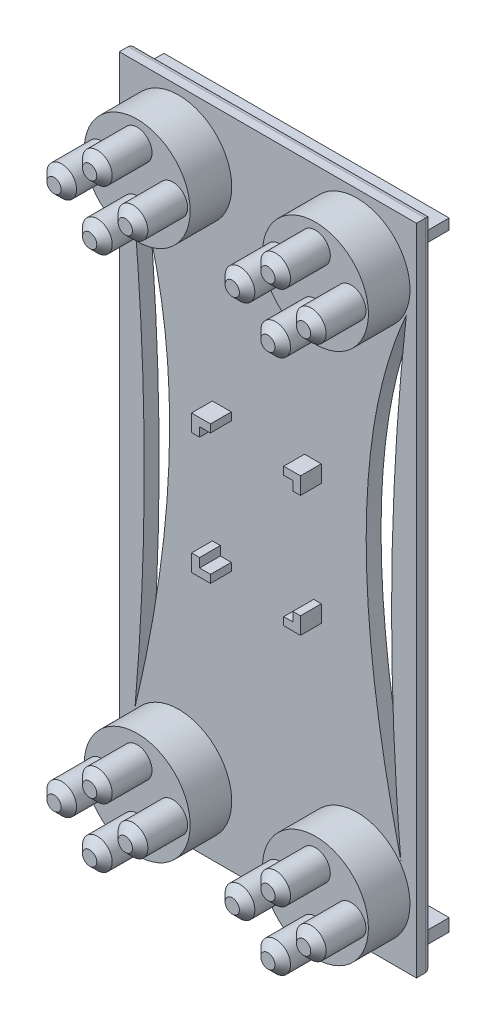
from build123d import *

# Parameters (mm, degrees)
CROQUIS1_W              = 50
CROQUIS1_H              = 110
SALIENTE_EXTRUIR1_DEPTH = 2.5
CROQUIS2_R              = 2.5
SALIENTE_EXTRUIR2_DEPTH = 15
CHAFL_N1_SIZE           = 1.3
REDONDEO1_R             = 1
CORTAR_EXTRUIR1_DEPTH   = 10
CROQUIS5_R              = 8.912982345
SALIENTE_EXTRUIR5_DEPTH = 7
SALIENTE_EXTRUIR6_DEPTH = 6
CROQUIS6_W              = 48
CROQUIS6_H              = 1.766405202
CROQUIS6_H_2            = 2.105673341
SALIENTE_EXTRUIR7_DEPTH = 4


with BuildPart() as part:
    # Croquis1 → Saliente-Extruir1 (new body)
    with BuildSketch(Plane.XY):
        Rectangle(CROQUIS1_W, CROQUIS1_H)
    extrude(amount=SALIENTE_EXTRUIR1_DEPTH)

    # Croquis2 → Saliente-Extruir2 (add)
    with BuildSketch(Plane.XY.offset(2.5)):
        with Locations((-15, 50)):
            Circle(CROQUIS2_R)
        with Locations((-21, 45)):
            Circle(CROQUIS2_R)
        with Locations((-15, 40)):
            Circle(CROQUIS2_R)
        with Locations((-9, 45)):
            Circle(CROQUIS2_R)
        with Locations((-15, -40)):
            Circle(CROQUIS2_R)
        with Locations((-9, -45)):
            Circle(CROQUIS2_R)
        with Locations((-15, -50)):
            Circle(CROQUIS2_R)
        with Locations((-21, -45)):
            Circle(CROQUIS2_R)
        with Locations((21, -45)):
            Circle(CROQUIS2_R)
        with Locations((15, -50)):
            Circle(CROQUIS2_R)
        with Locations((9, -45)):
            Circle(CROQUIS2_R)
        with Locations((15, -40)):
            Circle(CROQUIS2_R)
        with Locations((21, 45)):
            Circle(CROQUIS2_R)
        with Locations((15, 50)):
            Circle(CROQUIS2_R)
        with Locations((9, 45)):
            Circle(CROQUIS2_R)
        with Locations((15, 40)):
            Circle(CROQUIS2_R)
    extrude(amount=SALIENTE_EXTRUIR2_DEPTH)

    # Chaflán1
    chafl_n1_edges = [part.edges().sort_by_distance(p)[0] for p in [
        (-23.5, 45, 17.5),
        (-17.5, 40, 17.5),
        (-17.5, 50, 17.5),
        (-11.5, 45, 17.5),
        (6.5, 45, 17.5),
        (12.5, 40, 17.5),
        (12.5, 50, 17.5),
        (18.5, 45, 17.5),
        (18.5, -45, 17.5),
        (12.5, -50, 17.5),
        (12.5, -40, 17.5),
        (6.5, -45, 17.5),
        (-11.5, -45, 17.5),
        (-17.5, -50, 17.5),
        (-17.5, -40, 17.5),
        (-23.5, -45, 17.5),
    ]]
    chamfer(chafl_n1_edges, length=CHAFL_N1_SIZE)

    # Redondeo1
    redondeo1_edges = [part.edges().sort_by_distance(p)[0] for p in [
        (0, 55, 0),
        (-25, 0, 0),
        (0, -55, 0),
        (25, 0, 0),
    ]]
    fillet(redondeo1_edges, radius=REDONDEO1_R)

    # Croquis3 → Cortar-Extruir1 (cut)
    with BuildSketch(Plane(origin=(0, 0, 0), x_dir=(-1, 0, 0), z_dir=(0, 0, -1))):
        with BuildLine():
            add(Edge.make_bspline(
                [(22.361475253, -39.186991388), (10.271319675, 11.528482347), (23.288602916, 40.714890738)],
                knots=[0, 0, 0, 1, 1, 1], degree=2))
            add(Edge.make_bspline(
                [(22.361475253, -39.186991388), (20.200722134, -14.449114626), (20.113642926, 12.226208442), (23.288602916, 40.714890738)],
                knots=[0, 0, 0, 0, 1, 1, 1, 1], degree=3))
        make_face()
        with BuildLine():
            add(Edge.make_bspline(
                [(-22.361475253, -39.186991388), (-20.200722134, -14.449114626), (-20.113642926, 12.226208442), (-23.288602916, 40.714890738)],
                knots=[0, 0, 0, 0, 1, 1, 1, 1], degree=3))
            add(Edge.make_bspline(
                [(-22.361475253, -39.186991388), (-10.271319675, 11.528482347), (-23.288602916, 40.714890738)],
                knots=[0, 0, 0, 1, 1, 1], degree=2))
        make_face()
    extrude(amount=-CORTAR_EXTRUIR1_DEPTH, mode=Mode.SUBTRACT)

    # Croquis5 → Saliente-Extruir5 (add)
    with BuildSketch(Plane.XY.offset(2.5)):
        with Locations((-15, 44.758672209)):
            Circle(CROQUIS5_R)
        with Locations((-15, -44.758672209)):
            Circle(CROQUIS5_R)
        with Locations((15, 44.758672209)):
            Circle(CROQUIS5_R)
        with Locations((15, -44.758672209)):
            Circle(CROQUIS5_R)
    extrude(amount=SALIENTE_EXTRUIR5_DEPTH)

    # Croquis4 → Saliente-Extruir6 (add)
    with BuildSketch(Plane(origin=(0, 0, 0), x_dir=(-1, 0, 0), z_dir=(0, 0, -1))):
        Polygon((-7.7, 9.070517568), (-7.7, 10.6), (-6.163131116, 10.6), (-6.163131116, 11.924666471), (-8.979725427, 11.924666471), (-8.979725427, 9.070517568), align=None)
        Polygon((-6.163131116, -10), (-7.7, -10), (-7.7, -8.470517568), (-8.979725427, -8.470517568), (-8.979725427, -11.324666471), (-6.163131116, -11.324666471), align=None)
        Polygon((6.163131116, 10.6), (8, 10.6), (8, 9.070517568), (9.349963895, 9.070517568), (9.349963895, 11.924666471), (6.163131116, 11.924666471), align=None)
        Polygon((9.349963895, -8.470517568), (8, -8.470517568), (8, -10), (6.163131116, -10), (6.163131116, -11.324666471), (9.349963895, -11.324666471), align=None)
    extrude(amount=-SALIENTE_EXTRUIR6_DEPTH)

    # Croquis6 → Saliente-Extruir7 (add)
    with BuildSketch(Plane(origin=(0, 0, 0), x_dir=(-1, 0, 0), z_dir=(0, 0, -1))):
        with Locations((0, 51.133202601)):
            Rectangle(CROQUIS6_W, CROQUIS6_H)
        with Locations((0, -51.002836671)):
            Rectangle(CROQUIS6_W, CROQUIS6_H_2)
    extrude(amount=SALIENTE_EXTRUIR7_DEPTH)


solid = part.part
